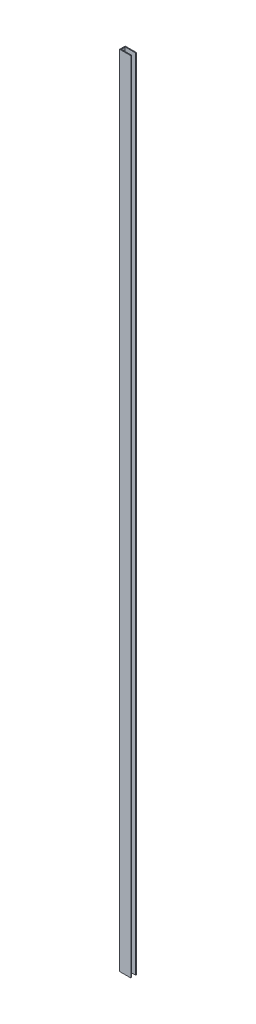
from build123d import *

# Parameters (mm, degrees)
EXTRUDE_1_DEPTH = 2000


with BuildPart() as part:
    # Эскиз2 → Бобышка-Вытянуть1 (new body)
    with BuildSketch(Plane(origin=(0, 0, 0), x_dir=(1, 0, 0), z_dir=(0, 1, 0))):
        Polygon((0, -7), (0, 7), (28, 7), (28, 5), (2, 5), (2, -5), (28, -5), (28, -7), align=None)
    extrude(amount=EXTRUDE_1_DEPTH)


solid = part.part
